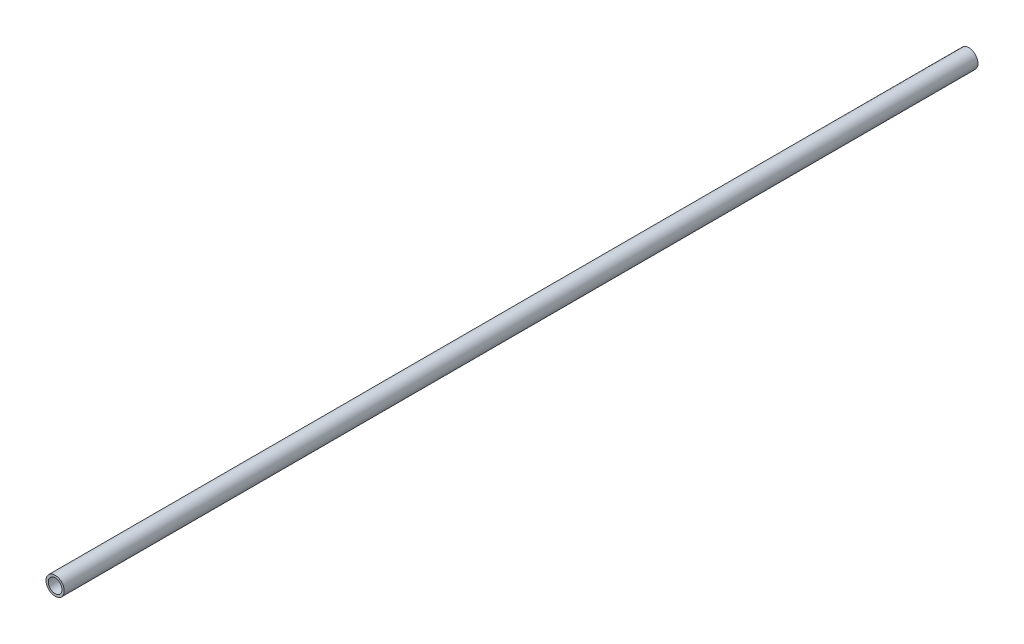
from build123d import *

# Parameters (mm, degrees)
SKETCH_1_R      = 10
SKETCH_1_R_2    = 7.5
EXTRUDE_1_DEPTH = 1000


with BuildPart() as part:
    # 草图1 → 凸台-拉伸1 (new body)
    with BuildSketch(Plane.XY):
        Circle(SKETCH_1_R)
        Circle(SKETCH_1_R_2, mode=Mode.SUBTRACT)
    extrude(amount=EXTRUDE_1_DEPTH)


solid = part.part
